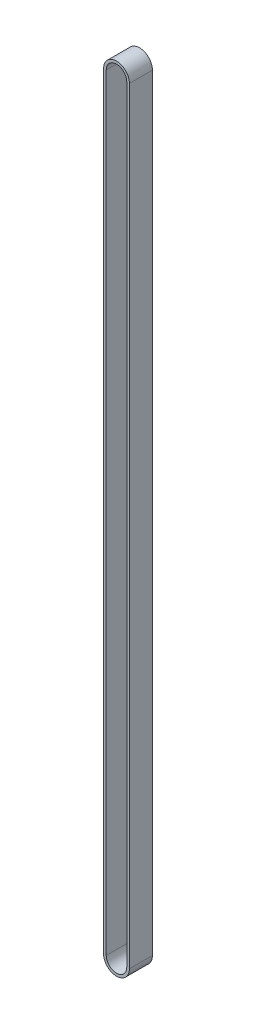
from build123d import *

# Parameters (mm, degrees)
EXTRUDE_THIN1_DEPTH = 12


with BuildPart() as part:
    # Sketch1 → Extrude-Thin1 (new body)
    with BuildSketch(Plane.XY):
        with BuildLine():
            Line((6.741, -400), (6.741, 0))
            ThreePointArc((6.741, 0), (0, 6.741), (-6.741, 0))
            Line((-6.741, 0), (-6.741, -400))
            ThreePointArc((-6.741, -400), (0, -406.741), (6.741, -400))
        make_face()
        with BuildLine():
            Line((5.361, -400), (5.361, 0))
            ThreePointArc((5.361, 0), (0, 5.361), (-5.361, 0))
            Line((-5.361, 0), (-5.361, -400))
            ThreePointArc((-5.361, -400), (0, -405.361), (5.361, -400))
        make_face(mode=Mode.SUBTRACT)
    extrude(amount=EXTRUDE_THIN1_DEPTH)


solid = part.part
